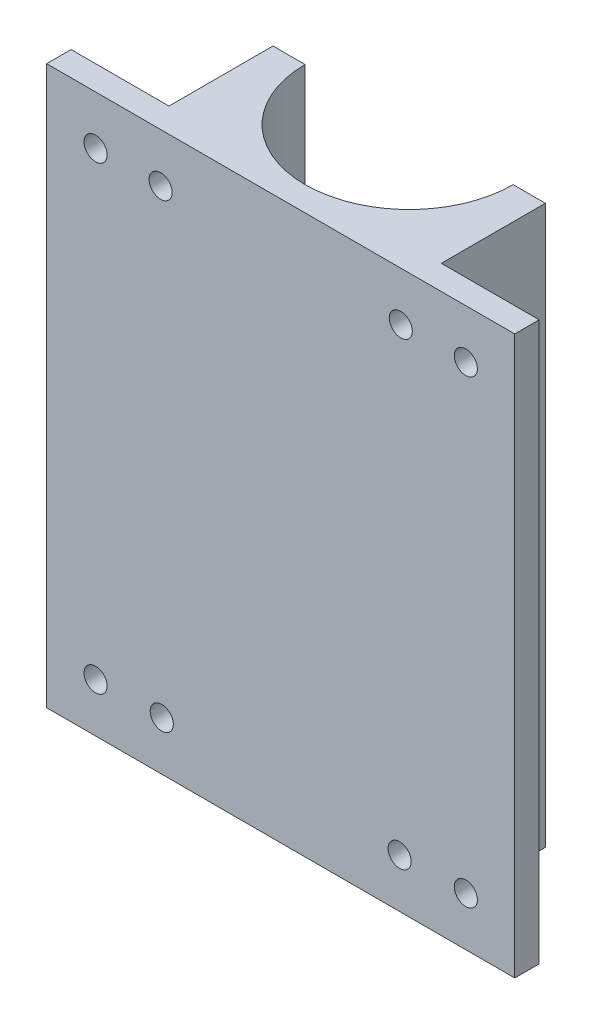
from build123d import *

# Parameters (mm, degrees)
BOSS_EXTRUDE3_DEPTH   = 72.39
BOSS_EXTRUDE4_DEPTH   = 51.39
F_3_0MM_DOWEL_HOLE1_D = 3
F_3_0MM_DOWEL_HOLE2_D = 3
F_3_0MM_DOWEL_HOLE4_D = 3


with BuildPart() as part:
    # Sketch1 → Boss-Extrude3 (new body)
    with BuildSketch(Plane(origin=(0, 0, 0), x_dir=(1, 0, 0), z_dir=(0, 1, 0))):
        with BuildLine():
            Line((-11.1466884, 17.698170271), (-23.8485284, 17.698170271))
            Line((-23.8485284, 17.698170271), (-23.8485284, 14.523170271))
            Line((-23.8485284, 14.523170271), (36.9033116, 14.523170271))
            Line((36.9033116, 14.523170271), (36.9033116, 17.698170271))
            Line((36.9033116, 17.698170271), (24.2033116, 17.698170271))
            Line((24.2033116, 17.698170271), (24.2033116, 31.198170271))
            Line((24.2033116, 31.198170271), (20.025, 31.198170271))
            ThreePointArc((20.025, 31.198170271), (6.525, 17.69817027), (-6.975, 31.198170271))
            Line((-6.975, 31.198170271), (-11.1466884, 31.198170271))
            Line((-11.1466884, 31.198170271), (-11.1466884, 17.698170271))
        make_face()
    extrude(amount=BOSS_EXTRUDE3_DEPTH)

    # Sketch1<13> → Boss-Extrude4 (add)
    with BuildSketch(Plane(origin=(0, 0, 0), x_dir=(1, 0, 0), z_dir=(0, 1, 0))):
        with BuildLine():
            Line((-6.975, 31.198170271), (-6.675, 31.198170271))
            ThreePointArc((-6.675, 31.198170271), (6.525, 17.99817027), (19.725, 31.198170271))
            Line((19.725, 31.198170271), (20.025, 31.198170271))
            ThreePointArc((20.025, 31.198170271), (6.525, 17.69817027), (-6.975, 31.198170271))
        make_face()
    extrude(amount=BOSS_EXTRUDE4_DEPTH)

    # Ø3.0mm Dowel Hole1 (through all)
    with Locations(Plane(origin=(0, 0, -17.698170271), x_dir=(-1, 0, 0), z_dir=(0, 0, -1))):
        with Locations((-30.5533116, 66.04), (-30.5533116, 6.35)):
            Hole(F_3_0MM_DOWEL_HOLE1_D / 2)

    # Ø3.0mm Dowel Hole2 (through all)
    with Locations(Plane(origin=(0, 0, -17.698170271), x_dir=(-1, 0, 0), z_dir=(0, 0, -1))):
        with Locations((17.4985284, 6.35), (17.4985284, 66.04)):
            Hole(F_3_0MM_DOWEL_HOLE2_D / 2)

    # Ø3.0mm Dowel Hole4 (through all)
    with Locations(Plane(origin=(0, 0, -31.198170271), x_dir=(-1, 0, 0), z_dir=(0, 0, -1))):
        with Locations((-22.1133116, 66.04), (9.0566884, 66.04), (8.9066884, 6.35), (-21.9633116, 6.35)):
            Hole(F_3_0MM_DOWEL_HOLE4_D / 2)


solid = part.part
